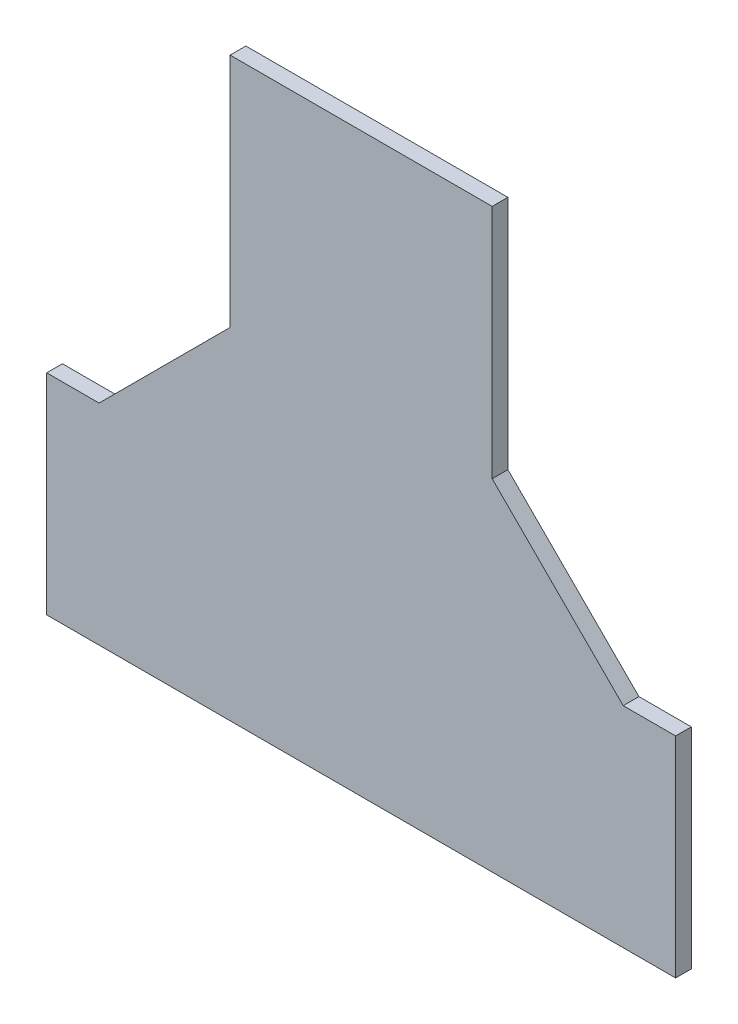
from build123d import *

# Parameters (mm, degrees)
EXTRUDE_1_DEPTH = 3


with BuildPart() as part:
    # 草图1 → 凸台-拉伸1 (new body)
    with BuildSketch(Plane.XY):
        Polygon((0, 0), (0, 40), (10, 40), (35, 65), (35, 110), (85, 110), (85, 65), (110, 40), (120, 40), (120, 0), align=None)
    extrude(amount=EXTRUDE_1_DEPTH)


solid = part.part
